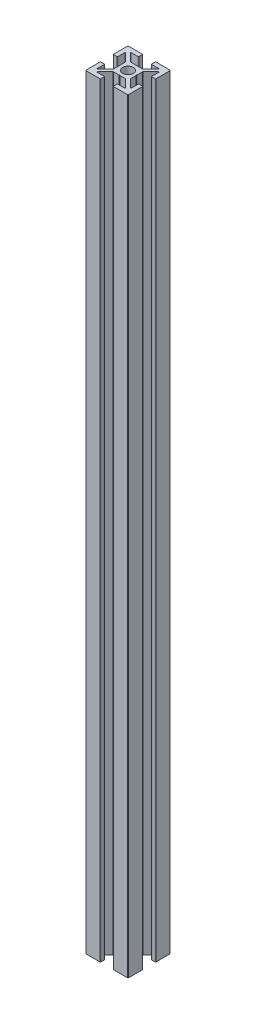
from build123d import *

# Parameters (mm, degrees)
SKETCH1_R           = 2.5
BOSS_EXTRUDE1_DEPTH = 360


with BuildPart() as part:
    # Sketch1 → Boss-Extrude1 (new body)
    with BuildSketch(Plane(origin=(0, 0, 0), x_dir=(1, 0, 0), z_dir=(0, 1, 0))):
        with BuildLine():
            Line((-2.997918472, 4.058578644), (-6.597918472, 7.658578644))
            ThreePointArc((-6.597918472, 7.658578644), (-6.621415508, 7.686854412), (-6.639339828, 7.718953455))
            ThreePointArc((-6.639339828, 7.718953455), (-6.656497116, 7.8), (-6.639339828, 7.881046545))
            ThreePointArc((-6.639339828, 7.881046545), (-6.565562901, 7.967644429), (-6.456497116, 8))
            Line((-6.456497116, 8), (-3.2, 8))
            ThreePointArc((-3.2, 8), (-3.058578644, 8.058578644), (-3, 8.2))
            Line((-3, 8.2), (-3, 9.8))
            ThreePointArc((-3, 9.8), (-3.058578644, 9.941421356), (-3.2, 10))
            Line((-3.2, 10), (-9.8, 10))
            ThreePointArc((-9.8, 10), (-9.941421356, 9.941421356), (-10, 9.8))
            Line((-10, 9.8), (-10, 3.2))
            ThreePointArc((-10, 3.2), (-9.941421356, 3.058578644), (-9.8, 3))
            Line((-9.8, 3), (-8.2, 3))
            ThreePointArc((-8.2, 3), (-8.058578644, 3.058578644), (-8, 3.2))
            Line((-8, 3.2), (-8, 6.456497116))
            ThreePointArc((-8, 6.456497116), (-7.967644429, 6.565562901), (-7.881046545, 6.639339828))
            ThreePointArc((-7.881046545, 6.639339828), (-7.8, 6.656497116), (-7.718953455, 6.639339828))
            ThreePointArc((-7.718953455, 6.639339828), (-7.686854412, 6.621415508), (-7.658578644, 6.597918472))
            Line((-7.658578644, 6.597918472), (-4.058578644, 2.997918472))
            ThreePointArc((-4.058578644, 2.997918472), (-4.015224093, 2.933033802), (-4, 2.856497116))
            Line((-4, 2.856497116), (-4, 0.130901699))
            ThreePointArc((-4, 0.130901699), (-3.99253254, 0.104615144), (-3.97236068, 0.08618034))
            Line((-3.97236068, 0.08618034), (-3.8, 0))
            Line((-3.8, 0), (-3.97236068, -0.08618034))
            ThreePointArc((-3.97236068, -0.08618034), (-3.99253254, -0.104615144), (-4, -0.130901699))
            Line((-4, -0.130901699), (-4, -2.856497116))
            ThreePointArc((-4, -2.856497116), (-4.015224093, -2.933033802), (-4.058578644, -2.997918472))
            Line((-4.058578644, -2.997918472), (-7.658578644, -6.597918472))
            ThreePointArc((-7.658578644, -6.597918472), (-7.686854412, -6.621415508), (-7.718953455, -6.639339828))
            ThreePointArc((-7.718953455, -6.639339828), (-7.8, -6.656497116), (-7.881046545, -6.639339828))
            ThreePointArc((-7.881046545, -6.639339828), (-7.967644429, -6.565562901), (-8, -6.456497116))
            Line((-8, -6.456497116), (-8, -3.2))
            ThreePointArc((-8, -3.2), (-8.058578644, -3.058578644), (-8.2, -3))
            Line((-8.2, -3), (-9.8, -3))
            ThreePointArc((-9.8, -3), (-9.941421356, -3.058578644), (-10, -3.2))
            Line((-10, -3.2), (-10, -9.8))
            ThreePointArc((-10, -9.8), (-9.941421356, -9.941421356), (-9.8, -10))
            Line((-9.8, -10), (-3.2, -10))
            ThreePointArc((-3.2, -10), (-3.058578644, -9.941421356), (-3, -9.8))
            Line((-3, -9.8), (-3, -8.2))
            ThreePointArc((-3, -8.2), (-3.058578644, -8.058578644), (-3.2, -8))
            Line((-3.2, -8), (-6.456497116, -8))
            ThreePointArc((-6.456497116, -8), (-6.565562901, -7.967644429), (-6.639339828, -7.881046545))
            ThreePointArc((-6.639339828, -7.881046545), (-6.656497116, -7.8), (-6.639339828, -7.718953455))
            ThreePointArc((-6.639339828, -7.718953455), (-6.621415508, -7.686854412), (-6.597918472, -7.658578644))
            Line((-6.597918472, -7.658578644), (-2.997918472, -4.058578644))
            ThreePointArc((-2.997918472, -4.058578644), (-2.933033802, -4.015224093), (-2.856497116, -4))
            Line((-2.856497116, -4), (-0.211803399, -4))
            ThreePointArc((-0.211803399, -4), (-0.200315753, -3.998662449), (-0.189442719, -3.99472136))
            Line((-0.189442719, -3.99472136), (0, -3.9))
            Line((0, -3.9), (0.189442719, -3.99472136))
            ThreePointArc((0.189442719, -3.99472136), (0.200315753, -3.998662449), (0.211803399, -4))
            Line((0.211803399, -4), (2.856497116, -4))
            ThreePointArc((2.856497116, -4), (2.933033802, -4.015224093), (2.997918472, -4.058578644))
            Line((2.997918472, -4.058578644), (6.597918472, -7.658578644))
            ThreePointArc((6.597918472, -7.658578644), (6.621415508, -7.686854412), (6.639339828, -7.718953455))
            ThreePointArc((6.639339828, -7.718953455), (6.656497116, -7.8), (6.639339828, -7.881046545))
            ThreePointArc((6.639339828, -7.881046545), (6.565562901, -7.967644429), (6.456497116, -8))
            Line((6.456497116, -8), (3.2, -8))
            ThreePointArc((3.2, -8), (3.058578644, -8.058578644), (3, -8.2))
            Line((3, -8.2), (3, -9.8))
            ThreePointArc((3, -9.8), (3.058578644, -9.941421356), (3.2, -10))
            Line((3.2, -10), (9.8, -10))
            ThreePointArc((9.8, -10), (9.941421356, -9.941421356), (10, -9.8))
            Line((10, -9.8), (10, -3.2))
            ThreePointArc((10, -3.2), (9.941421356, -3.058578644), (9.8, -3))
            Line((9.8, -3), (8.2, -3))
            ThreePointArc((8.2, -3), (8.058578644, -3.058578644), (8, -3.2))
            Line((8, -3.2), (8, -6.456497116))
            ThreePointArc((8, -6.456497116), (7.967644429, -6.565562901), (7.881046545, -6.639339828))
            ThreePointArc((7.881046545, -6.639339828), (7.8, -6.656497116), (7.718953455, -6.639339828))
            ThreePointArc((7.718953455, -6.639339828), (7.686854412, -6.621415508), (7.658578644, -6.597918472))
            Line((7.658578644, -6.597918472), (4.058578644, -2.997918472))
            ThreePointArc((4.058578644, -2.997918472), (4.015224093, -2.933033802), (4, -2.856497116))
            Line((4, -2.856497116), (4, -0.130901699))
            ThreePointArc((4, -0.130901699), (3.99253254, -0.104615144), (3.97236068, -0.08618034))
            Line((3.97236068, -0.08618034), (3.8, 0))
            Line((3.8, 0), (3.97236068, 0.08618034))
            ThreePointArc((3.97236068, 0.08618034), (3.99253254, 0.104615144), (4, 0.130901699))
            Line((4, 0.130901699), (4, 2.856497116))
            ThreePointArc((4, 2.856497116), (4.015224093, 2.933033802), (4.058578644, 2.997918472))
            Line((4.058578644, 2.997918472), (7.658578644, 6.597918472))
            ThreePointArc((7.658578644, 6.597918472), (7.686854412, 6.621415508), (7.718953455, 6.639339828))
            ThreePointArc((7.718953455, 6.639339828), (7.8, 6.656497116), (7.881046545, 6.639339828))
            ThreePointArc((7.881046545, 6.639339828), (7.967644429, 6.565562901), (8, 6.456497116))
            Line((8, 6.456497116), (8, 3.2))
            ThreePointArc((8, 3.2), (8.058578644, 3.058578644), (8.2, 3))
            Line((8.2, 3), (9.8, 3))
            ThreePointArc((9.8, 3), (9.941421356, 3.058578644), (10, 3.2))
            Line((10, 3.2), (10, 9.8))
            ThreePointArc((10, 9.8), (9.941421356, 9.941421356), (9.8, 10))
            Line((9.8, 10), (3.2, 10))
            ThreePointArc((3.2, 10), (3.058578644, 9.941421356), (3, 9.8))
            Line((3, 9.8), (3, 8.2))
            ThreePointArc((3, 8.2), (3.058578644, 8.058578644), (3.2, 8))
            Line((3.2, 8), (6.456497116, 8))
            ThreePointArc((6.456497116, 8), (6.565562901, 7.967644429), (6.639339828, 7.881046545))
            ThreePointArc((6.639339828, 7.881046545), (6.656497116, 7.8), (6.639339828, 7.718953455))
            ThreePointArc((6.639339828, 7.718953455), (6.621415508, 7.686854412), (6.597918472, 7.658578644))
            Line((6.597918472, 7.658578644), (2.997918472, 4.058578644))
            ThreePointArc((2.997918472, 4.058578644), (2.933033802, 4.015224093), (2.856497116, 4))
            Line((2.856497116, 4), (0.211803399, 4))
            ThreePointArc((0.211803399, 4), (0.200315753, 3.998662449), (0.189442719, 3.99472136))
            Line((0.189442719, 3.99472136), (0, 3.9))
            Line((0, 3.9), (-0.189442719, 3.99472136))
            ThreePointArc((-0.189442719, 3.99472136), (-0.200315753, 3.998662449), (-0.211803399, 4))
            Line((-0.211803399, 4), (-2.856497116, 4))
            ThreePointArc((-2.856497116, 4), (-2.933033802, 4.015224093), (-2.997918472, 4.058578644))
        make_face()
        Circle(SKETCH1_R, mode=Mode.SUBTRACT)
    extrude(amount=BOSS_EXTRUDE1_DEPTH)


solid = part.part
